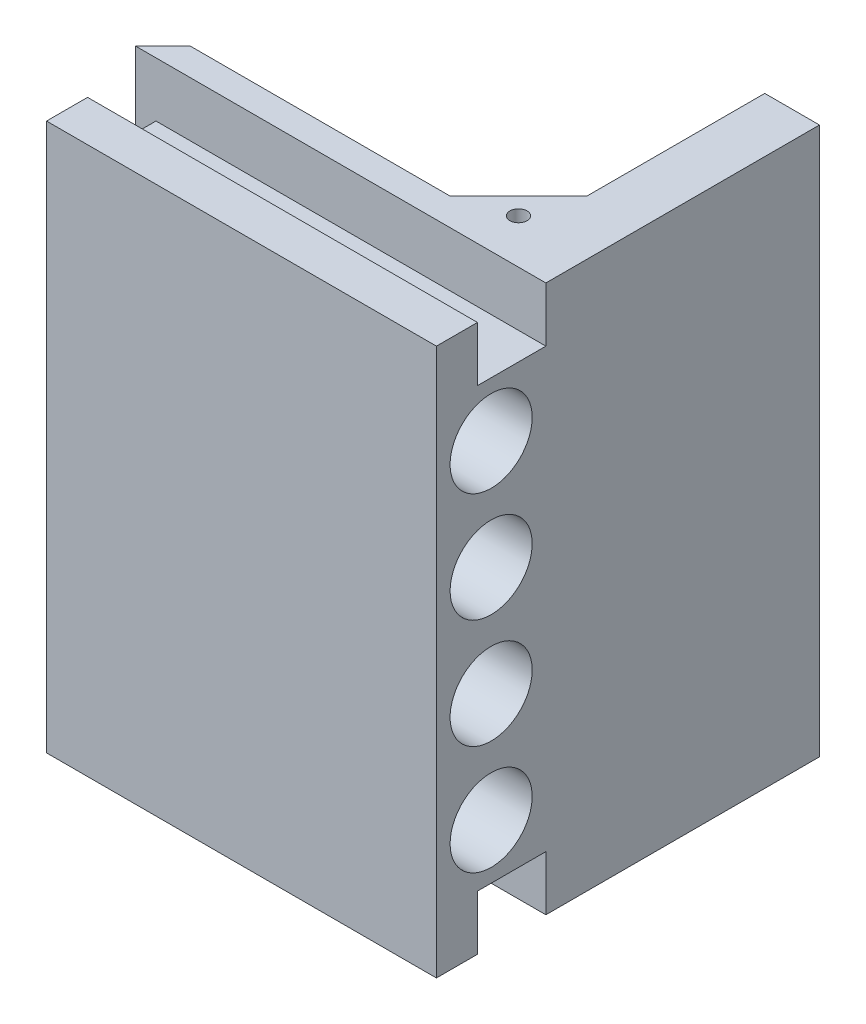
from build123d import *

# Parameters (mm, degrees)
SKETCH1_W           = 20
SKETCH1_H           = 40
BOSS_EXTRUDE1_DEPTH = 80
SKETCH8_W           = 16
SKETCH8_H           = 64
BOSS_EXTRUDE2_DEPTH = 57
SKETCH10_R          = 6
CUT_EXTRUDE1_DEPTH  = 51
SKETCH12_W          = 57
SKETCH12_H          = 6
BOSS_EXTRUDE3_DEPTH = 8
SKETCH14_W          = 57
SKETCH14_H          = 6
BOSS_EXTRUDE4_DEPTH = 8
SKETCH17_W          = 48
SKETCH17_H          = 80
CUT_EXTRUDE4_DEPTH  = 36
CHAMFER1_SIZE       = 10
SKETCH16_W          = 48
SKETCH16_H          = 72
CUT_EXTRUDE5_DEPTH  = 10
SKETCH19_R          = 1.25
CUT_EXTRUDE6_DEPTH  = 105.703357948


with BuildPart() as part:
    # Sketch1 → Boss-Extrude1 (new body)
    with BuildSketch(Plane(origin=(0, 0, 0), x_dir=(1, 0, 0), z_dir=(0, 1, 0))):
        Polygon((-17.351649908, 20.312727502), (-57.351649908, -19.687272498), (-17.351649908, -19.687272498), align=None)
        with Locations((-7.351649908, 0.312727502)):
            Rectangle(SKETCH1_W, SKETCH1_H)
    extrude(amount=-BOSS_EXTRUDE1_DEPTH)

    # Sketch8 → Boss-Extrude2 (add)
    with BuildSketch(Plane(origin=(2.648350092, 0, 0), x_dir=(0, 0, -1), z_dir=(1, 0, 0))):
        with Locations((-27.687272498, -40)):
            Rectangle(SKETCH8_W, SKETCH8_H)
    extrude(amount=-BOSS_EXTRUDE2_DEPTH)

    # Sketch10 → Cut-Extrude1 (cut)
    with BuildSketch(Plane(origin=(2.648350092, 0, 0), x_dir=(0, 0, -1), z_dir=(1, 0, 0))):
        with Locations((-27.687272498, -16)):
            Circle(SKETCH10_R)
        with Locations(Location((-27.687272498, -32, 0), (0, 0, 180))):
            Circle(SKETCH10_R)
        with Locations(Location((-27.687272498, -64, 0), (0, 0, 180))):
            Circle(SKETCH10_R)
        with Locations((-27.687272498, -48)):
            Circle(SKETCH10_R)
    extrude(amount=-CUT_EXTRUDE1_DEPTH, mode=Mode.SUBTRACT)

    # Sketch12 → Boss-Extrude3 (add)
    with BuildSketch(Plane.XZ.offset(72)):
        with Locations((-25.851649908, 32.687272498)):
            Rectangle(SKETCH12_W, SKETCH12_H)
    extrude(amount=BOSS_EXTRUDE3_DEPTH)

    # Sketch14 → Boss-Extrude4 (add)
    with BuildSketch(Plane(origin=(0, -8, 0), x_dir=(1, 0, 0), z_dir=(0, 1, 0))):
        with Locations((-25.851649908, -32.687272498)):
            Rectangle(SKETCH14_W, SKETCH14_H)
    extrude(amount=BOSS_EXTRUDE4_DEPTH)

    # Sketch17 → Cut-Extrude4 (cut)
    with BuildSketch(Plane(origin=(0, 0, -20.312727502), x_dir=(-1, 0, 0), z_dir=(0, 0, -1))):
        with Locations((29.351649908, -40)):
            Rectangle(SKETCH17_W, SKETCH17_H)
    extrude(amount=-CUT_EXTRUDE4_DEPTH, mode=Mode.SUBTRACT)

    # Chamfer1
    chamfer1_edges = [part.edges().sort_by_distance(p)[0] for p in [
        (-5.351649908, -40, 15.687272498),
    ]]
    chamfer(chamfer1_edges, length=CHAMFER1_SIZE)

    # Sketch16 → Cut-Extrude5 (cut)
    with BuildSketch(Plane(origin=(0, 0, 15.687272498), x_dir=(-1, 0, 0), z_dir=(0, 0, -1))):
        with Locations((29.351649908, -40)):
            Rectangle(SKETCH16_W, SKETCH16_H)
    extrude(amount=CUT_EXTRUDE5_DEPTH, mode=Mode.SUBTRACT)

    # Sketch19 → Cut-Extrude6 (cut, through all)
    with BuildSketch(Plane(origin=(0, 0, 0), x_dir=(1, 0, 0), z_dir=(0, 1, 0))):
        with Locations(Location((-7.851649908, -13.187272498, 0), (0, 0, 270))):
            Circle(SKETCH19_R)
    extrude(amount=-CUT_EXTRUDE6_DEPTH, mode=Mode.SUBTRACT)


solid = part.part
